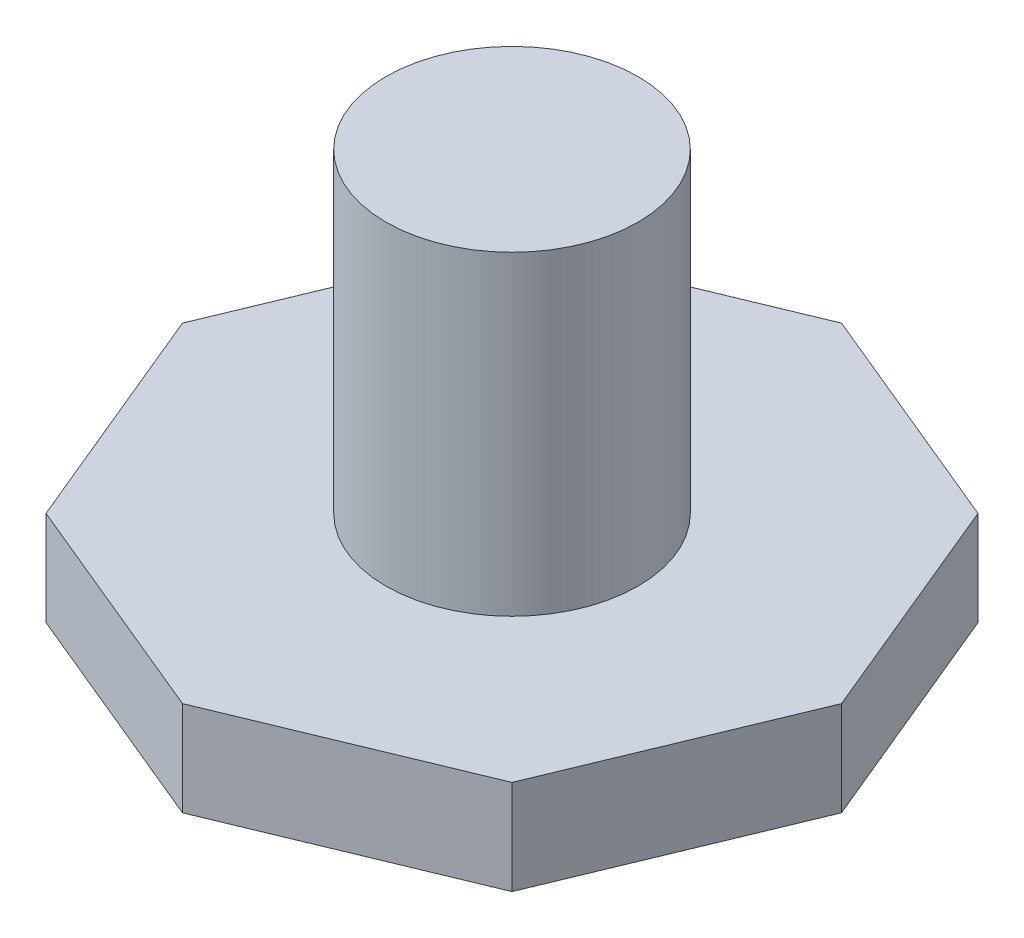
from build123d import *

# Parameters (mm, degrees)
EXTRUDE_1_DEPTH = 1.5
SKETCH_2_R      = 2
EXTRUDE_2_DEPTH = 5


with BuildPart() as part:
    # 草图1 → 凸台-拉伸1 (new body)
    with BuildSketch(Plane(origin=(0, 0, 0), x_dir=(1, 0, 0), z_dir=(0, 1, 0))):
        Polygon((5.22625186, 0), (3.69551813, 3.69551813), (0, 5.22625186), (-3.69551813, 3.69551813), (-5.22625186, 0), (-3.69551813, -3.69551813), (0, -5.22625186), (3.69551813, -3.69551813), align=None)
    extrude(amount=EXTRUDE_1_DEPTH)

    # 草图2 → 凸台-拉伸2 (add)
    with BuildSketch(Plane(origin=(0, 1.5, 0), x_dir=(1, 0, 0), z_dir=(0, 1, 0))):
        with Locations(Location((0, 0, 0), (0, 0, 270))):
            Circle(SKETCH_2_R)
    extrude(amount=EXTRUDE_2_DEPTH)


solid = part.part
